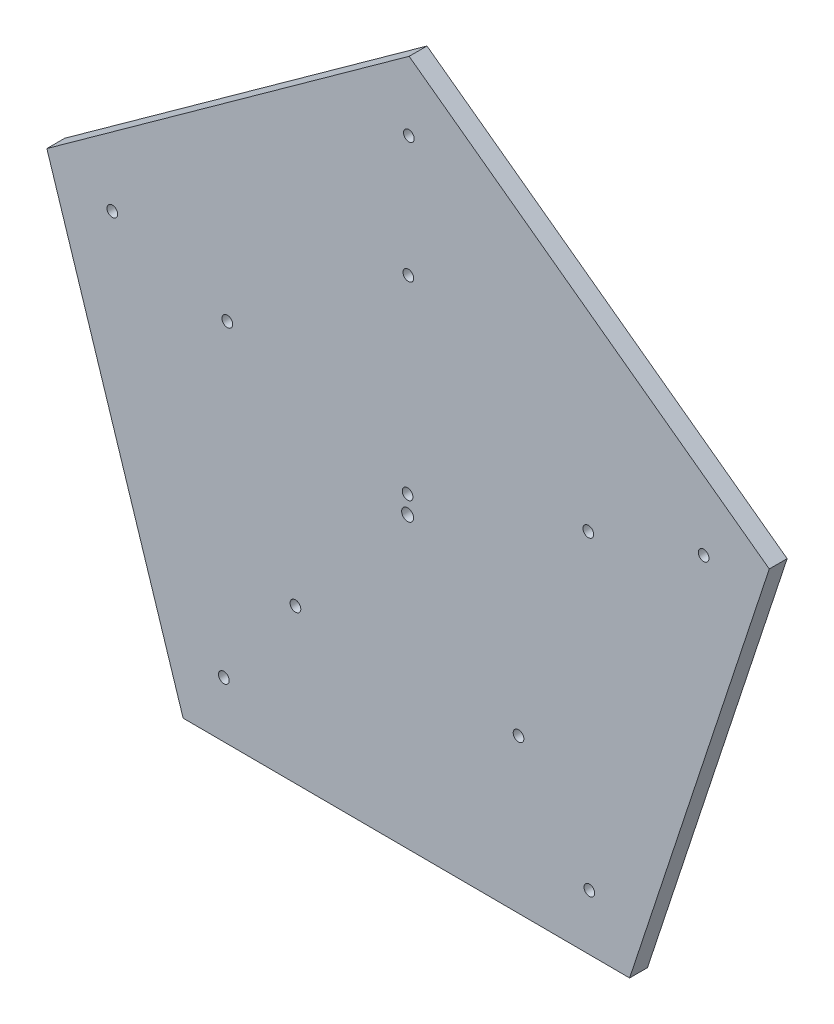
from build123d import *

# Parameters (mm, degrees)
BOSS_EXTRUDE1_DEPTH = 3
SKETCH3_R           = 0.9
CUT_EXTRUDE1_DEPTH  = 3
SKETCH5_R           = 0.9
CUT_EXTRUDE2_DEPTH  = 3
CIRPATTERN1_COUNT   = 5
SKETCH6_R           = 1
CUT_EXTRUDE3_DEPTH  = 3


with BuildPart() as part:
    # Sketch1 → Boss-Extrude1 (new body)
    with BuildSketch(Plane.XY):
        Polygon((-37.706506674, -51.464286136), (37.293493326, -51.764357899), (60.755153109, 19.472153549), (0.255256287, 63.798810626), (-60.597396047, 19.95767986), align=None)
    extrude(amount=BOSS_EXTRUDE1_DEPTH)

    # Sketch3 → Cut-Extrude1 (cut)
    with BuildSketch(Plane.XY.offset(3)):
        Circle(SKETCH3_R)
    extrude(amount=-CUT_EXTRUDE1_DEPTH, mode=Mode.SUBTRACT)

    # Sketch5 → Cut-Extrude2 (cut)
    with BuildSketch(Plane.XY.offset(3)):
        with Locations((-30.864859889, -42.126362822)):
            Circle(SKETCH5_R)
        with Locations((-18.84066677, -25.714964105)):
            Circle(SKETCH5_R)
    cut_extrude2 = extrude(amount=-CUT_EXTRUDE2_DEPTH, mode=Mode.SUBTRACT)

    # CirPattern1: Cut-Extrude2 ×5 about axis
    cirpattern1_axis = Axis((0, 0, 0), (0, 0, 1))
    for i in range(1, CIRPATTERN1_COUNT):
        add(cut_extrude2.rotate(cirpattern1_axis, i * 360 / CIRPATTERN1_COUNT), mode=Mode.SUBTRACT)

    # Sketch6 → Cut-Extrude3 (cut)
    with BuildSketch(Plane(origin=(0, 0, 0), x_dir=(-1, 0, 0), z_dir=(0, 0, -1))):
        with Locations((0, -3)):
            Circle(SKETCH6_R)
    extrude(amount=-CUT_EXTRUDE3_DEPTH, mode=Mode.SUBTRACT)


solid = part.part
